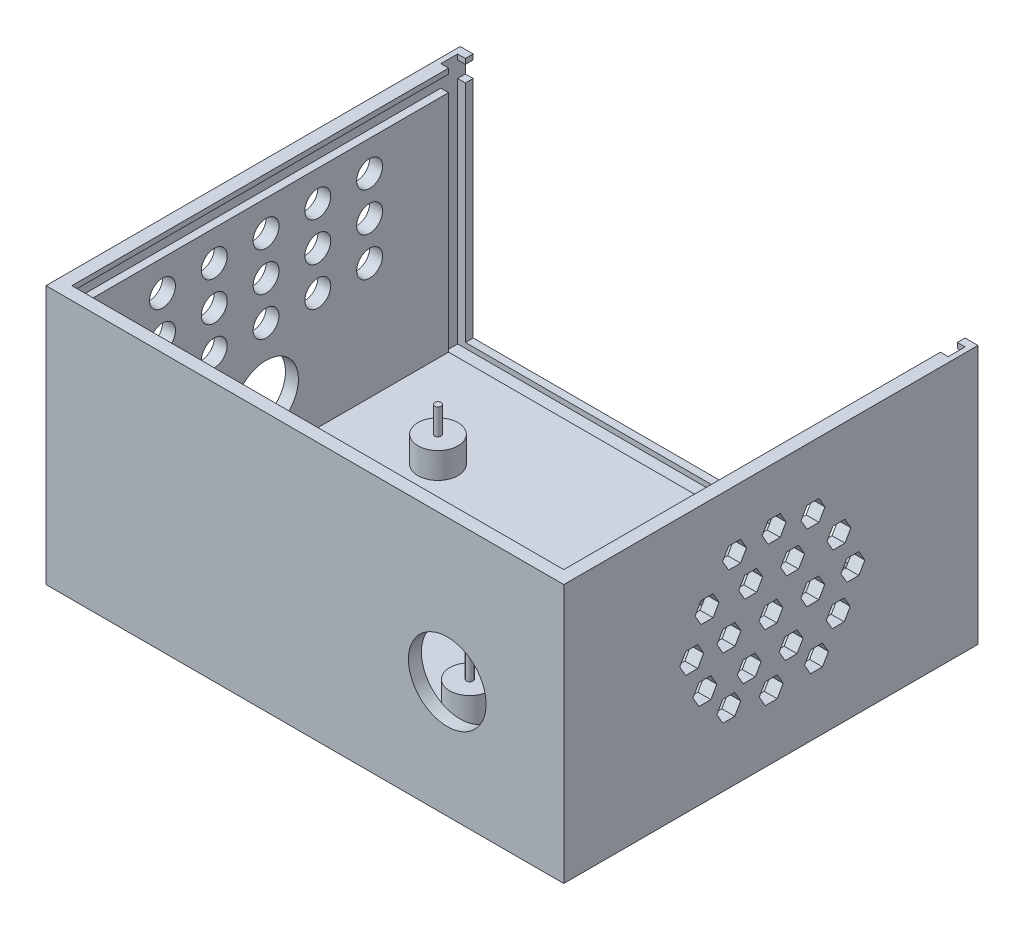
from build123d import *

# Parameters (mm, degrees)
SKETCH1_W           = 200
SKETCH1_H           = 160
BOSS_EXTRUDE1_DEPTH = 100
SHELL2_T            = -5
SKETCH2_W           = 196
SKETCH2_H           = 6.5
CUT_EXTRUDE1_DEPTH  = 97
SKETCH3_W           = 196
SKETCH3_H           = 6.2
CUT_EXTRUDE2_DEPTH  = 157
SKETCH4_R           = 15
CUT_EXTRUDE3_DEPTH  = 273.075357208
CUT_EXTRUDE4_DEPTH  = 5
SKETCH6_R           = 1.25
BOSS_EXTRUDE2_DEPTH = 20
SKETCH7_R           = 7.75
SKETCH7_R_2         = 1.25
BOSS_EXTRUDE3_DEPTH = 10
SKETCH8_R           = 12.5
SKETCH8_R_2         = 5
CUT_EXTRUDE5_DEPTH  = 5


with BuildPart() as part:
    # Sketch1 → Boss-Extrude1 (new body)
    with BuildSketch(Plane(origin=(0, 0, 0), x_dir=(1, 0, 0), z_dir=(0, 1, 0))):
        with Locations((100, 80)):
            Rectangle(SKETCH1_W, SKETCH1_H)
    extrude(amount=BOSS_EXTRUDE1_DEPTH)

    # Shell2
    shell2_openings = [part.faces().sort_by_distance(p)[0] for p in [
        (100, 100, -80),
        (100, 50, -160),
    ]]
    offset(amount=SHELL2_T, openings=shell2_openings, kind=Kind.INTERSECTION)

    # Sketch2 → Cut-Extrude1 (cut)
    with BuildSketch(Plane(origin=(0, 100, 0), x_dir=(1, 0, 0), z_dir=(0, 1, 0))):
        with Locations((100, 153.75)):
            Rectangle(SKETCH2_W, SKETCH2_H)
    extrude(amount=-CUT_EXTRUDE1_DEPTH, mode=Mode.SUBTRACT)

    # Sketch3 → Cut-Extrude2 (cut)
    with BuildSketch(Plane(origin=(0, 0, -160), x_dir=(-1, 0, 0), z_dir=(0, 0, -1))):
        with Locations((-100, 94.9)):
            Rectangle(SKETCH3_W, SKETCH3_H)
    extrude(amount=-CUT_EXTRUDE2_DEPTH, mode=Mode.SUBTRACT)

    # Sketch4 → Cut-Extrude3 (cut, through all)
    with BuildSketch(Plane(origin=(0, 0, -5), x_dir=(-1, 0, 0), z_dir=(0, 0, -1))):
        with Locations((-155, 45)):
            Circle(SKETCH4_R)
    extrude(amount=-CUT_EXTRUDE3_DEPTH, mode=Mode.SUBTRACT)

    # Sketch5 → Cut-Extrude4 (cut)
    with BuildSketch(Plane(origin=(200, 0, 0), x_dir=(0, 0, -1), z_dir=(1, 0, 0))):
        Polygon((68.441020245, 50.331851937), (66.131619168, 54.331851937), (61.512817015, 54.331851937), (59.203415938, 50.331851937), (61.512817015, 46.331851937), (66.131619168, 46.331851937), align=None)
        Polygon((84.618802154, 50), (82.309401077, 54), (77.690598923, 54), (75.381197846, 50), (77.690598923, 46), (82.309401077, 46), align=None)
        Polygon((74.50790233, 60.176296078), (76.817303407, 64.176296078), (74.50790233, 68.176296078), (69.889100176, 68.176296078), (67.5796991, 64.176296078), (69.889100176, 60.176296078), align=None)
        Polygon((86.066882085, 59.844444141), (90.685684238, 59.844444141), (92.995085315, 63.844444141), (90.685684238, 67.844444141), (86.066882085, 67.844444141), (83.757481008, 63.844444141), align=None)
        Polygon((91.558979755, 49.668148063), (93.868380832, 45.668148063), (98.487182985, 45.668148063), (100.796584062, 49.668148063), (98.487182985, 53.668148063), (93.868380832, 53.668148063), align=None)
        Polygon((85.49209767, 39.823703922), (83.182696593, 35.823703922), (85.49209767, 31.823703922), (90.110899824, 31.823703922), (92.4203009, 35.823703922), (90.110899824, 39.823703922), align=None)
        Polygon((73.933117915, 40.155555859), (69.314315762, 40.155555859), (67.004914685, 36.155555859), (69.314315762, 32.155555859), (73.933117915, 32.155555859), (76.242518992, 36.155555859), align=None)
        Polygon((57.642141445, 60.103624342), (59.951542522, 64.103624342), (57.642141445, 68.103624342), (53.023339291, 68.103624342), (50.713938215, 64.103624342), (53.023339291, 60.103624342), align=None)
        Polygon((51.720243637, 46.056331866), (54.029644713, 50.056331866), (51.720243637, 54.056331866), (47.101441483, 54.056331866), (44.792040406, 50.056331866), (47.101441483, 46.056331866), align=None)
        Polygon((56.815830123, 33.11078782), (59.1252312, 37.11078782), (56.815830123, 41.11078782), (52.197027969, 41.11078782), (49.887626893, 37.11078782), (52.197027969, 33.11078782), align=None)
        Polygon((66.04297322, 22.919614847), (68.352374296, 26.919614847), (66.04297322, 30.919614847), (61.424171066, 30.919614847), (59.114769989, 26.919614847), (61.424171066, 22.919614847), align=None)
        Polygon((82.431481108, 20.578399435), (84.740882185, 24.578399435), (82.431481108, 28.578399435), (77.812678954, 28.578399435), (75.503277878, 24.578399435), (77.812678954, 20.578399435), align=None)
        Polygon((99.921737426, 22.506459186), (102.231138502, 26.506459186), (99.921737426, 30.506459186), (95.302935272, 30.506459186), (92.993534195, 26.506459186), (95.302935272, 22.506459186), align=None)
        Polygon((108.3225692, 33.386224927), (110.631970277, 37.386224927), (108.3225692, 41.386224927), (103.703767047, 41.386224927), (101.39436597, 37.386224927), (103.703767047, 33.386224927), align=None)
        Polygon((113.969029901, 46.056331866), (116.278430978, 50.056331866), (113.969029901, 54.056331866), (109.350227748, 54.056331866), (107.040826671, 50.056331866), (109.350227748, 46.056331866), align=None)
        Polygon((108.598006308, 59.552750127), (110.907407385, 63.552750127), (108.598006308, 67.552750127), (103.979204154, 67.552750127), (101.669803077, 63.552750127), (103.979204154, 59.552750127), align=None)
        Polygon((98.574670101, 71.528102354), (100.884071178, 75.528102354), (98.574670101, 79.528102354), (93.955867948, 79.528102354), (91.646466871, 75.528102354), (93.955867948, 71.528102354), align=None)
        Polygon((83.56334775, 74.000874378), (85.872748827, 78.000874378), (83.56334775, 82.000874378), (78.944545596, 82.000874378), (76.63514452, 78.000874378), (78.944545596, 74.000874378), align=None)
        Polygon((68.276588291, 73.030682559), (70.585989368, 77.030682559), (68.276588291, 81.030682559), (63.657786138, 81.030682559), (61.348385061, 77.030682559), (63.657786138, 73.030682559), align=None)
    extrude(amount=-CUT_EXTRUDE4_DEPTH, mode=Mode.SUBTRACT)

    # Sketch6 → Boss-Extrude2 (add)
    with BuildSketch(Plane(origin=(0, 5, 0), x_dir=(1, 0, 0), z_dir=(0, 1, 0))):
        with Locations(Location((128.5, 35.2, 0), (0, 0, 90))):
            Circle(SKETCH6_R)
        with Locations(Location((131.4, 118.2, 0), (0, 0, 90))):
            Circle(SKETCH6_R)
        with Locations(Location((37.5, 31, 0), (0, 0, 90))):
            Circle(SKETCH6_R)
        with Locations(Location((40.4, 111, 0), (0, 0, 90))):
            Circle(SKETCH6_R)
    extrude(amount=BOSS_EXTRUDE2_DEPTH)

    # Sketch7 → Boss-Extrude3 (add)
    # profile 1 of 4: a face of its own
    with BuildSketch(Plane(origin=(0, 5, 0), x_dir=(1, 0, 0), z_dir=(0, 1, 0))):
        with Locations(Location((131.4, 118.2, 0), (0, 0, 90))):
            Circle(SKETCH7_R)
        with Locations(Location((131.4, 118.2, 0), (0, 0, 270))):
            Circle(SKETCH7_R_2, mode=Mode.SUBTRACT)
    # profile 2 of 4: a face of its own
    with BuildSketch(Plane(origin=(0, 5, 0), x_dir=(1, 0, 0), z_dir=(0, 1, 0))):
        with Locations(Location((40.4, 111, 0), (0, 0, 90))):
            Circle(SKETCH7_R)
        with Locations(Location((40.4, 111, 0), (0, 0, 270))):
            Circle(SKETCH7_R_2, mode=Mode.SUBTRACT)
    # profile 3 of 4: a face of its own
    with BuildSketch(Plane(origin=(0, 5, 0), x_dir=(1, 0, 0), z_dir=(0, 1, 0))):
        with Locations(Location((128.5, 35.2, 0), (0, 0, 90))):
            Circle(SKETCH7_R)
        with Locations(Location((128.5, 35.2, 0), (0, 0, 270))):
            Circle(SKETCH7_R_2, mode=Mode.SUBTRACT)
    # profile 4 of 4: a face of its own
    with BuildSketch(Plane(origin=(0, 5, 0), x_dir=(1, 0, 0), z_dir=(0, 1, 0))):
        with Locations(Location((37.5, 31, 0), (0, 0, 90))):
            Circle(SKETCH7_R)
        with Locations(Location((37.5, 31, 0), (0, 0, 270))):
            Circle(SKETCH7_R_2, mode=Mode.SUBTRACT)
    extrude(amount=BOSS_EXTRUDE3_DEPTH)

    # Sketch8 → Cut-Extrude5 (cut)
    with BuildSketch(Plane.ZY):
        with Locations((-80, 25)):
            Circle(SKETCH8_R)
        with Locations((-80, 50)):
            Circle(SKETCH8_R_2)
        with Locations((-60, 50)):
            Circle(SKETCH8_R_2)
        with Locations((-40, 50)):
            Circle(SKETCH8_R_2)
        with Locations((-60, 65)):
            Circle(SKETCH8_R_2)
        with Locations((-40, 65)):
            Circle(SKETCH8_R_2)
        with Locations((-60, 80)):
            Circle(SKETCH8_R_2)
        with Locations((-40, 80)):
            Circle(SKETCH8_R_2)
        with Locations((-80, 65)):
            Circle(SKETCH8_R_2)
        with Locations((-80, 80)):
            Circle(SKETCH8_R_2)
        with Locations((-120, 50)):
            Circle(SKETCH8_R_2)
        with Locations((-100, 50)):
            Circle(SKETCH8_R_2)
        with Locations((-120, 65)):
            Circle(SKETCH8_R_2)
        with Locations((-100, 65)):
            Circle(SKETCH8_R_2)
        with Locations((-120, 80)):
            Circle(SKETCH8_R_2)
        with Locations((-100, 80)):
            Circle(SKETCH8_R_2)
    extrude(amount=-CUT_EXTRUDE5_DEPTH, mode=Mode.SUBTRACT)


solid = part.part
